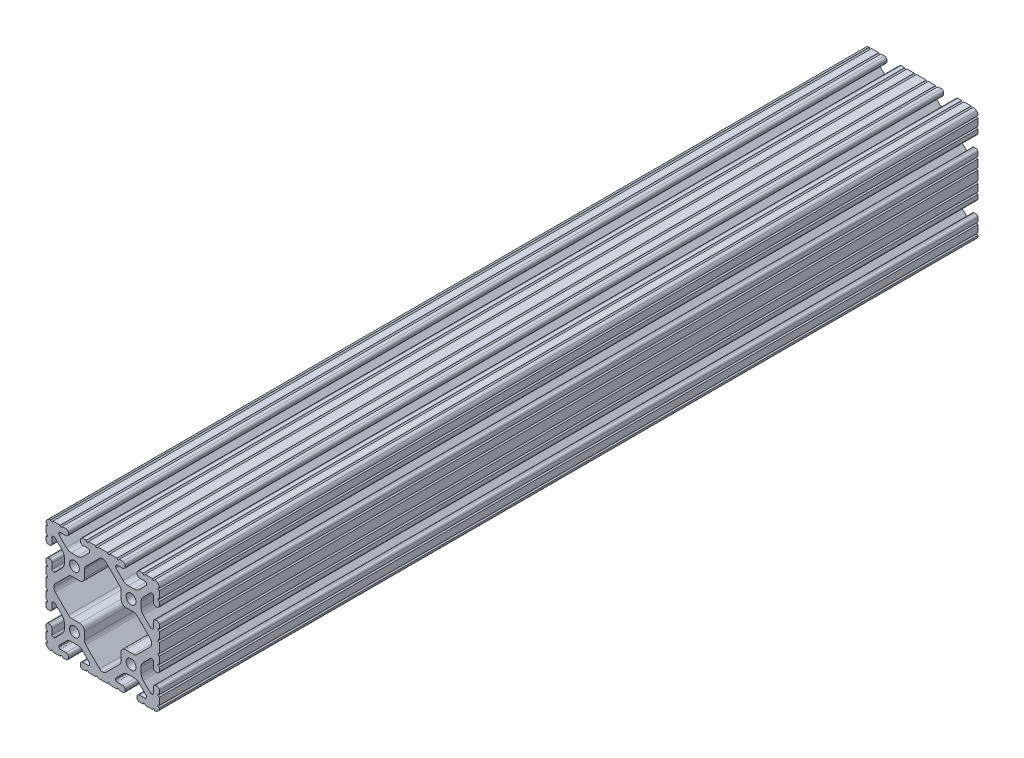
from build123d import *

# Parameters (mm, degrees)
BOSS_EXTRUDE1_DEPTH      = 275
BOSS_EXTRUDE1_DEPTH_BACK = 275
SKETCH3_R                = 3.3274


with BuildPart() as part:
    # Sketch3 → Boss-Extrude1 (new, two sides: drawn at the far end of the back side and taken through both)
    with BuildSketch(Plane.XY.offset(-BOSS_EXTRUDE1_DEPTH_BACK)):
        with BuildLine():
            Line((34.036, 28.448), (34.036, 24.630196049))
            ThreePointArc((34.036, 24.630196049), (34.497248241, 23.51664429), (35.6108, 23.055396049))
            Line((35.6108, 23.055396049), (36.525200183, 23.055396049))
            ThreePointArc((36.525200183, 23.055396049), (37.638751813, 23.516644236), (38.1, 24.630195866))
            Line((38.1, 24.630195866), (38.1, 27.023826138))
            ThreePointArc((38.1, 27.023826138), (37.117780706, 27.7845421), (38.1, 28.545258062))
            Line((38.1, 28.545258062), (38.1, 33.373016026))
            ThreePointArc((38.1, 33.373016026), (37.141472621, 34.109236774), (38.1, 34.845457521))
            ThreePointArc((38.1, 34.845457521), (37.837757813, 36.120195002), (37.086123144, 37.182631793))
            ThreePointArc((37.086123144, 37.182631793), (36.106286572, 37.843374398), (34.952681874, 38.1))
            ThreePointArc((34.952681874, 38.1), (34.190730434, 37.320215335), (33.428778994, 38.1))
            Line((33.428778994, 38.1), (28.601105935, 38.1))
            ThreePointArc((28.601105935, 38.1), (27.839158581, 37.32021942), (27.077211227, 38.1))
            Line((27.077211227, 38.1), (24.6888, 38.1))
            ThreePointArc((24.6888, 38.1), (23.575248241, 37.638751759), (23.114, 36.5252))
            Line((23.114, 36.5252), (23.114, 35.6108))
            ThreePointArc((23.114, 35.6108), (23.575248241, 34.497248241), (24.6888, 34.036))
            Line((24.6888, 34.036), (28.448, 34.036))
            ThreePointArc((28.448, 34.036), (29.076617928, 33.775617928), (29.337, 33.147))
            Line((29.337, 33.147), (29.337, 32.720693454))
            ThreePointArc((29.337, 32.720693454), (29.326675076, 32.273872751), (29.100231244, 31.888543625))
            Line((29.100231244, 31.888543625), (24.409287499, 27.197588341))
            ThreePointArc((24.409287499, 27.197588341), (22.868340045, 26.167958114), (21.050667579, 25.8064))
            Line((21.050667579, 25.8064), (17.049332421, 25.8064))
            ThreePointArc((17.049332421, 25.8064), (15.231659955, 26.167958114), (13.690712501, 27.197588341))
            Line((13.690712501, 27.197588341), (9.023381298, 31.864931024))
            ThreePointArc((9.023381298, 31.864931024), (8.830670886, 32.153343113), (8.763, 32.493548179))
            Line((8.763, 32.493548179), (8.763, 33.147))
            ThreePointArc((8.763, 33.147), (9.023382072, 33.775617928), (9.652, 34.036))
            Line((9.652, 34.036), (13.4112, 34.036))
            ThreePointArc((13.4112, 34.036), (14.524751759, 34.497248241), (14.986, 35.6108))
            Line((14.986, 35.6108), (14.986, 36.5252))
            ThreePointArc((14.986, 36.5252), (14.524751759, 37.638751759), (13.4112, 38.1))
            Line((13.4112, 38.1), (11.128867074, 38.1))
            ThreePointArc((11.128867074, 38.1), (10.367071033, 37.320370693), (9.605274992, 38.1))
            Line((9.605274992, 38.1), (4.777313069, 38.1))
            ThreePointArc((4.777313069, 38.1), (4.015517029, 37.320370693), (3.253720988, 38.1))
            Line((3.253720988, 38.1), (-3.253720988, 38.1))
            ThreePointArc((-3.253720988, 38.1), (-4.015517029, 37.320370693), (-4.777313069, 38.1))
            Line((-4.777313069, 38.1), (-9.605274992, 38.1))
            ThreePointArc((-9.605274992, 38.1), (-10.367071033, 37.320370693), (-11.128867074, 38.1))
            Line((-11.128867074, 38.1), (-13.4112, 38.1))
            ThreePointArc((-13.4112, 38.1), (-14.524751759, 37.638751759), (-14.986, 36.5252))
            Line((-14.986, 36.5252), (-14.986, 35.6108))
            ThreePointArc((-14.986, 35.6108), (-14.524751759, 34.497248241), (-13.4112, 34.036))
            Line((-13.4112, 34.036), (-9.652, 34.036))
            ThreePointArc((-9.652, 34.036), (-9.023382072, 33.775617928), (-8.763, 33.147))
            Line((-8.763, 33.147), (-8.763, 32.493548179))
            ThreePointArc((-8.763, 32.493548179), (-8.830670886, 32.153343113), (-9.023381298, 31.864931024))
            Line((-9.023381298, 31.864931024), (-13.690712501, 27.197588341))
            ThreePointArc((-13.690712501, 27.197588341), (-15.231659955, 26.167958114), (-17.049332421, 25.8064))
            Line((-17.049332421, 25.8064), (-21.050667579, 25.8064))
            ThreePointArc((-21.050667579, 25.8064), (-22.868340045, 26.167958114), (-24.409287499, 27.197588341))
            Line((-24.409287499, 27.197588341), (-29.100231244, 31.888543625))
            ThreePointArc((-29.100231244, 31.888543625), (-29.326675076, 32.273872751), (-29.337, 32.720693454))
            Line((-29.337, 32.720693454), (-29.337, 33.147))
            ThreePointArc((-29.337, 33.147), (-29.076617928, 33.775617928), (-28.448, 34.036))
            Line((-28.448, 34.036), (-24.6888, 34.036))
            ThreePointArc((-24.6888, 34.036), (-23.575248241, 34.497248241), (-23.114, 35.6108))
            Line((-23.114, 35.6108), (-23.114, 36.5252))
            ThreePointArc((-23.114, 36.5252), (-23.575248241, 37.638751759), (-24.6888, 38.1))
            Line((-24.6888, 38.1), (-27.077211227, 38.1))
            ThreePointArc((-27.077211227, 38.1), (-27.839158581, 37.32021942), (-28.601105935, 38.1))
            Line((-28.601105935, 38.1), (-33.428778994, 38.1))
            ThreePointArc((-33.428778994, 38.1), (-34.190730434, 37.320215335), (-34.952681874, 38.1))
            ThreePointArc((-34.952681874, 38.1), (-36.106286572, 37.843374398), (-37.086123144, 37.182631793))
            ThreePointArc((-37.086123144, 37.182631793), (-37.837757813, 36.120195002), (-38.1, 34.845457521))
            ThreePointArc((-38.1, 34.845457521), (-37.141472621, 34.109236774), (-38.1, 33.373016026))
            Line((-38.1, 33.373016026), (-38.1, 28.545258062))
            ThreePointArc((-38.1, 28.545258062), (-37.117780706, 27.7845421), (-38.1, 27.023826138))
            Line((-38.1, 27.023826138), (-38.1, 24.630195866))
            ThreePointArc((-38.1, 24.630195866), (-37.638751813, 23.516644236), (-36.525200183, 23.055396049))
            Line((-36.525200183, 23.055396049), (-35.6108, 23.055396049))
            ThreePointArc((-35.6108, 23.055396049), (-34.497248241, 23.51664429), (-34.036, 24.630196049))
            Line((-34.036, 24.630196049), (-34.036, 28.448))
            ThreePointArc((-34.036, 28.448), (-33.775617928, 29.076617928), (-33.147, 29.337))
            Line((-33.147, 29.337), (-32.664287242, 29.337))
            ThreePointArc((-32.664287242, 29.337), (-32.324081166, 29.269328695), (-32.03566854, 29.076617155))
            Line((-32.03566854, 29.076617155), (-27.19758008, 24.238516795))
            ThreePointArc((-27.19758008, 24.238516795), (-26.167955879, 22.697572205), (-25.8064, 20.879905136))
            Line((-25.8064, 20.879905136), (-25.8064, 17.220094864))
            ThreePointArc((-25.8064, 17.220094864), (-26.167955879, 15.402427795), (-27.19758008, 13.861483205))
            Line((-27.19758008, 13.861483205), (-31.948944541, 9.110107057))
            ThreePointArc((-31.948944541, 9.110107057), (-32.333417096, 8.853210196), (-32.786933649, 8.763))
            Line((-32.786933649, 8.763), (-33.060275787, 8.763))
            ThreePointArc((-33.060275787, 8.763), (-33.750216995, 9.048783005), (-34.036, 9.738724213))
            Line((-34.036, 9.738724213), (-34.036, 13.469803585))
            ThreePointArc((-34.036, 13.469803585), (-34.497248348, 14.583355603), (-35.610800366, 15.044603951))
            Line((-35.610800366, 15.044603951), (-36.5252, 15.044603951))
            ThreePointArc((-36.5252, 15.044603951), (-37.638751759, 14.58335571), (-38.1, 13.469803951))
            Line((-38.1, 13.469803951), (-38.1, 11.075039289))
            ThreePointArc((-38.1, 11.075039289), (-37.117000248, 10.313517272), (-38.1, 9.551995255))
            Line((-38.1, 9.551995255), (-38.1, 4.723759308))
            ThreePointArc((-38.1, 4.723759308), (-37.117000248, 3.962237292), (-38.1, 3.200715275))
            Line((-38.1, 3.200715275), (-38.1, -3.200715275))
            ThreePointArc((-38.1, -3.200715275), (-37.117000248, -3.962237292), (-38.1, -4.723759308))
            Line((-38.1, -4.723759308), (-38.1, -9.551995255))
            ThreePointArc((-38.1, -9.551995255), (-37.117000248, -10.313517272), (-38.1, -11.075039289))
            Line((-38.1, -11.075039289), (-38.1, -13.469803951))
            ThreePointArc((-38.1, -13.469803951), (-37.638751759, -14.58335571), (-36.5252, -15.044603951))
            Line((-36.5252, -15.044603951), (-35.610800366, -15.044603951))
            ThreePointArc((-35.610800366, -15.044603951), (-34.497248348, -14.583355603), (-34.036, -13.469803585))
            Line((-34.036, -13.469803585), (-34.036, -9.738724213))
            ThreePointArc((-34.036, -9.738724213), (-33.750216995, -9.048783005), (-33.060275787, -8.763))
            Line((-33.060275787, -8.763), (-32.786933649, -8.763))
            ThreePointArc((-32.786933649, -8.763), (-32.333417096, -8.853210196), (-31.948944541, -9.110107057))
            Line((-31.948944541, -9.110107057), (-27.19758008, -13.861483205))
            ThreePointArc((-27.19758008, -13.861483205), (-26.167955879, -15.402427795), (-25.8064, -17.220094864))
            Line((-25.8064, -17.220094864), (-25.8064, -20.879905136))
            ThreePointArc((-25.8064, -20.879905136), (-26.167955879, -22.697572205), (-27.19758008, -24.238516795))
            Line((-27.19758008, -24.238516795), (-32.03566854, -29.076617155))
            ThreePointArc((-32.03566854, -29.076617155), (-32.324081166, -29.269328695), (-32.664287242, -29.337))
            Line((-32.664287242, -29.337), (-33.147, -29.337))
            ThreePointArc((-33.147, -29.337), (-33.775617928, -29.076617928), (-34.036, -28.448))
            Line((-34.036, -28.448), (-34.036, -24.630196049))
            ThreePointArc((-34.036, -24.630196049), (-34.497248241, -23.51664429), (-35.6108, -23.055396049))
            Line((-35.6108, -23.055396049), (-36.525200183, -23.055396049))
            ThreePointArc((-36.525200183, -23.055396049), (-37.638751813, -23.516644236), (-38.1, -24.630195866))
            Line((-38.1, -24.630195866), (-38.1, -27.023826138))
            ThreePointArc((-38.1, -27.023826138), (-37.117780706, -27.7845421), (-38.1, -28.545258062))
            Line((-38.1, -28.545258062), (-38.1, -33.373016026))
            ThreePointArc((-38.1, -33.373016026), (-37.141472621, -34.109236774), (-38.1, -34.845457521))
            ThreePointArc((-38.1, -34.845457521), (-37.837757813, -36.120195002), (-37.086123144, -37.182631793))
            ThreePointArc((-37.086123144, -37.182631793), (-36.106286572, -37.843374398), (-34.952681874, -38.1))
            ThreePointArc((-34.952681874, -38.1), (-34.190730434, -37.320215335), (-33.428778994, -38.1))
            Line((-33.428778994, -38.1), (-28.601105935, -38.1))
            ThreePointArc((-28.601105935, -38.1), (-27.839158581, -37.32021942), (-27.077211227, -38.1))
            Line((-27.077211227, -38.1), (-24.6888, -38.1))
            ThreePointArc((-24.6888, -38.1), (-23.575248241, -37.638751759), (-23.114, -36.5252))
            Line((-23.114, -36.5252), (-23.114, -35.6108))
            ThreePointArc((-23.114, -35.6108), (-23.575248241, -34.497248241), (-24.6888, -34.036))
            Line((-24.6888, -34.036), (-28.448, -34.036))
            ThreePointArc((-28.448, -34.036), (-29.076617928, -33.775617928), (-29.337, -33.147))
            Line((-29.337, -33.147), (-29.337, -32.720693454))
            ThreePointArc((-29.337, -32.720693454), (-29.326675076, -32.273872751), (-29.100231244, -31.888543625))
            Line((-29.100231244, -31.888543625), (-24.409287499, -27.197588341))
            ThreePointArc((-24.409287499, -27.197588341), (-22.868340045, -26.167958114), (-21.050667579, -25.8064))
            Line((-21.050667579, -25.8064), (-17.049332421, -25.8064))
            ThreePointArc((-17.049332421, -25.8064), (-15.231659955, -26.167958114), (-13.690712501, -27.197588341))
            Line((-13.690712501, -27.197588341), (-9.023381298, -31.864931024))
            ThreePointArc((-9.023381298, -31.864931024), (-8.830670886, -32.153343113), (-8.763, -32.493548179))
            Line((-8.763, -32.493548179), (-8.763, -33.147))
            ThreePointArc((-8.763, -33.147), (-9.023382072, -33.775617928), (-9.652, -34.036))
            Line((-9.652, -34.036), (-13.4112, -34.036))
            ThreePointArc((-13.4112, -34.036), (-14.524751759, -34.497248241), (-14.986, -35.6108))
            Line((-14.986, -35.6108), (-14.986, -36.5252))
            ThreePointArc((-14.986, -36.5252), (-14.524751759, -37.638751759), (-13.4112, -38.1))
            Line((-13.4112, -38.1), (-11.128867074, -38.1))
            ThreePointArc((-11.128867074, -38.1), (-10.367071033, -37.320370693), (-9.605274992, -38.1))
            Line((-9.605274992, -38.1), (-4.777313069, -38.1))
            ThreePointArc((-4.777313069, -38.1), (-4.015517029, -37.320370693), (-3.253720988, -38.1))
            Line((-3.253720988, -38.1), (3.253720988, -38.1))
            ThreePointArc((3.253720988, -38.1), (4.015517029, -37.320370693), (4.777313069, -38.1))
            Line((4.777313069, -38.1), (9.605274992, -38.1))
            ThreePointArc((9.605274992, -38.1), (10.367071033, -37.320370693), (11.128867074, -38.1))
            Line((11.128867074, -38.1), (13.4112, -38.1))
            ThreePointArc((13.4112, -38.1), (14.524751759, -37.638751759), (14.986, -36.5252))
            Line((14.986, -36.5252), (14.986, -35.6108))
            ThreePointArc((14.986, -35.6108), (14.524751759, -34.497248241), (13.4112, -34.036))
            Line((13.4112, -34.036), (9.652, -34.036))
            ThreePointArc((9.652, -34.036), (9.023382072, -33.775617928), (8.763, -33.147))
            Line((8.763, -33.147), (8.763, -32.493548179))
            ThreePointArc((8.763, -32.493548179), (8.830670886, -32.153343113), (9.023381298, -31.864931024))
            Line((9.023381298, -31.864931024), (13.690712501, -27.197588341))
            ThreePointArc((13.690712501, -27.197588341), (15.231659955, -26.167958114), (17.049332421, -25.8064))
            Line((17.049332421, -25.8064), (21.050667579, -25.8064))
            ThreePointArc((21.050667579, -25.8064), (22.868340045, -26.167958114), (24.409287499, -27.197588341))
            Line((24.409287499, -27.197588341), (29.100231244, -31.888543625))
            ThreePointArc((29.100231244, -31.888543625), (29.326675076, -32.273872751), (29.337, -32.720693454))
            Line((29.337, -32.720693454), (29.337, -33.147))
            ThreePointArc((29.337, -33.147), (29.076617928, -33.775617928), (28.448, -34.036))
            Line((28.448, -34.036), (24.6888, -34.036))
            ThreePointArc((24.6888, -34.036), (23.575248241, -34.497248241), (23.114, -35.6108))
            Line((23.114, -35.6108), (23.114, -36.5252))
            ThreePointArc((23.114, -36.5252), (23.575248241, -37.638751759), (24.6888, -38.1))
            Line((24.6888, -38.1), (27.077211227, -38.1))
            ThreePointArc((27.077211227, -38.1), (27.839158581, -37.32021942), (28.601105935, -38.1))
            Line((28.601105935, -38.1), (33.428778994, -38.1))
            ThreePointArc((33.428778994, -38.1), (34.190730434, -37.320215335), (34.952681874, -38.1))
            ThreePointArc((34.952681874, -38.1), (36.106286572, -37.843374398), (37.086123144, -37.182631793))
            ThreePointArc((37.086123144, -37.182631793), (37.837757813, -36.120195002), (38.1, -34.845457521))
            ThreePointArc((38.1, -34.845457521), (37.141472621, -34.109236774), (38.1, -33.373016026))
            Line((38.1, -33.373016026), (38.1, -28.545258062))
            ThreePointArc((38.1, -28.545258062), (37.117780706, -27.7845421), (38.1, -27.023826138))
            Line((38.1, -27.023826138), (38.1, -24.630195866))
            ThreePointArc((38.1, -24.630195866), (37.638751813, -23.516644236), (36.525200183, -23.055396049))
            Line((36.525200183, -23.055396049), (35.6108, -23.055396049))
            ThreePointArc((35.6108, -23.055396049), (34.497248241, -23.51664429), (34.036, -24.630196049))
            Line((34.036, -24.630196049), (34.036, -28.448))
            ThreePointArc((34.036, -28.448), (33.775617928, -29.076617928), (33.147, -29.337))
            Line((33.147, -29.337), (32.664287242, -29.337))
            ThreePointArc((32.664287242, -29.337), (32.324081166, -29.269328695), (32.03566854, -29.076617155))
            Line((32.03566854, -29.076617155), (27.19758008, -24.238516795))
            ThreePointArc((27.19758008, -24.238516795), (26.167955879, -22.697572205), (25.8064, -20.879905136))
            Line((25.8064, -20.879905136), (25.8064, -17.220094864))
            ThreePointArc((25.8064, -17.220094864), (26.167955879, -15.402427795), (27.19758008, -13.861483205))
            Line((27.19758008, -13.861483205), (31.948944541, -9.110107057))
            ThreePointArc((31.948944541, -9.110107057), (32.333417096, -8.853210196), (32.786933649, -8.763))
            Line((32.786933649, -8.763), (33.060275787, -8.763))
            ThreePointArc((33.060275787, -8.763), (33.750216995, -9.048783005), (34.036, -9.738724213))
            Line((34.036, -9.738724213), (34.036, -13.469803585))
            ThreePointArc((34.036, -13.469803585), (34.497248348, -14.583355603), (35.610800366, -15.044603951))
            Line((35.610800366, -15.044603951), (36.5252, -15.044603951))
            ThreePointArc((36.5252, -15.044603951), (37.638751759, -14.58335571), (38.1, -13.469803951))
            Line((38.1, -13.469803951), (38.1, -11.075039289))
            ThreePointArc((38.1, -11.075039289), (37.117000248, -10.313517272), (38.1, -9.551995255))
            Line((38.1, -9.551995255), (38.1, -4.723759308))
            ThreePointArc((38.1, -4.723759308), (37.117000248, -3.962237292), (38.1, -3.200715275))
            Line((38.1, -3.200715275), (38.1, 3.200715275))
            ThreePointArc((38.1, 3.200715275), (37.117000248, 3.962237292), (38.1, 4.723759308))
            Line((38.1, 4.723759308), (38.1, 9.551995255))
            ThreePointArc((38.1, 9.551995255), (37.117000248, 10.313517272), (38.1, 11.075039289))
            Line((38.1, 11.075039289), (38.1, 13.469803951))
            ThreePointArc((38.1, 13.469803951), (37.638751759, 14.58335571), (36.5252, 15.044603951))
            Line((36.5252, 15.044603951), (35.610800366, 15.044603951))
            ThreePointArc((35.610800366, 15.044603951), (34.497248348, 14.583355603), (34.036, 13.469803585))
            Line((34.036, 13.469803585), (34.036, 9.738724213))
            ThreePointArc((34.036, 9.738724213), (33.750216995, 9.048783005), (33.060275787, 8.763))
            Line((33.060275787, 8.763), (32.786933649, 8.763))
            ThreePointArc((32.786933649, 8.763), (32.333417096, 8.853210196), (31.948944541, 9.110107057))
            Line((31.948944541, 9.110107057), (27.19758008, 13.861483205))
            ThreePointArc((27.19758008, 13.861483205), (26.167955879, 15.402427795), (25.8064, 17.220094864))
            Line((25.8064, 17.220094864), (25.8064, 20.879905136))
            ThreePointArc((25.8064, 20.879905136), (26.167955879, 22.697572205), (27.19758008, 24.238516795))
            Line((27.19758008, 24.238516795), (32.03566854, 29.076617155))
            ThreePointArc((32.03566854, 29.076617155), (32.324081166, 29.269328695), (32.664287242, 29.337))
            Line((32.664287242, 29.337), (33.147, 29.337))
            ThreePointArc((33.147, 29.337), (33.775617928, 29.076617928), (34.036, 28.448))
        make_face()
        with Locations((19.05, 19.05)):
            Circle(SKETCH3_R, mode=Mode.SUBTRACT)
        with Locations((-19.05, 19.05)):
            Circle(SKETCH3_R, mode=Mode.SUBTRACT)
        with Locations((19.05, -19.05)):
            Circle(SKETCH3_R, mode=Mode.SUBTRACT)
        with Locations((-19.05, -19.05)):
            Circle(SKETCH3_R, mode=Mode.SUBTRACT)
        with BuildLine():
            Line((-11.363666791, -22.843321003), (-2.051515952, -32.155494748))
            ThreePointArc((-2.051515952, -32.155494748), (-1.11031328, -32.786013752), (0, -33.011005091))
            ThreePointArc((0, -33.011005091), (1.11031328, -32.786013752), (2.051515952, -32.155494748))
            Line((2.051515952, -32.155494748), (11.363666791, -22.843321003))
            ThreePointArc((11.363666791, -22.843321003), (12.051918263, -21.813277828), (12.2936, -20.598259734))
            Line((12.2936, -20.598259734), (12.2936, -15.4686))
            ThreePointArc((12.2936, -15.4686), (13.22353597, -13.22353597), (15.4686, -12.2936))
            Line((15.4686, -12.2936), (20.769026744, -12.2936))
            ThreePointArc((20.769026744, -12.2936), (21.984048446, -12.051916769), (23.014093535, -11.363661269))
            Line((23.014093535, -11.363661269), (31.902125566, -2.475607377))
            ThreePointArc((31.902125566, -2.475607377), (32.607298578, -1.335259481), (32.728725173, 0))
            ThreePointArc((32.728725173, 0), (32.607298578, 1.335259481), (31.902125566, 2.475607377))
            Line((31.902125566, 2.475607377), (23.014093535, 11.363661269))
            ThreePointArc((23.014093535, 11.363661269), (21.984048446, 12.051916769), (20.769026744, 12.2936))
            Line((20.769026744, 12.2936), (15.4686, 12.2936))
            ThreePointArc((15.4686, 12.2936), (13.22353597, 13.22353597), (12.2936, 15.4686))
            Line((12.2936, 15.4686), (12.2936, 20.598259734))
            ThreePointArc((12.2936, 20.598259734), (12.051918263, 21.813277828), (11.363666791, 22.843321003))
            Line((11.363666791, 22.843321003), (2.051515952, 32.155494748))
            ThreePointArc((2.051515952, 32.155494748), (1.11031328, 32.786013752), (0, 33.011005091))
            ThreePointArc((0, 33.011005091), (-1.11031328, 32.786013752), (-2.051515952, 32.155494748))
            Line((-2.051515952, 32.155494748), (-11.363666791, 22.843321003))
            ThreePointArc((-11.363666791, 22.843321003), (-12.051918263, 21.813277828), (-12.2936, 20.598259734))
            Line((-12.2936, 20.598259734), (-12.2936, 15.4686))
            ThreePointArc((-12.2936, 15.4686), (-13.22353597, 13.22353597), (-15.4686, 12.2936))
            Line((-15.4686, 12.2936), (-20.769026744, 12.2936))
            ThreePointArc((-20.769026744, 12.2936), (-21.984048446, 12.051916769), (-23.014093535, 11.363661269))
            Line((-23.014093535, 11.363661269), (-31.902125566, 2.475607377))
            ThreePointArc((-31.902125566, 2.475607377), (-32.607298578, 1.335259481), (-32.728725173, 0))
            ThreePointArc((-32.728725173, 0), (-32.607298578, -1.335259481), (-31.902125566, -2.475607377))
            Line((-31.902125566, -2.475607377), (-23.014093535, -11.363661269))
            ThreePointArc((-23.014093535, -11.363661269), (-21.984048446, -12.051916769), (-20.769026744, -12.2936))
            Line((-20.769026744, -12.2936), (-15.4686, -12.2936))
            ThreePointArc((-15.4686, -12.2936), (-13.22353597, -13.22353597), (-12.2936, -15.4686))
            Line((-12.2936, -15.4686), (-12.2936, -20.598259734))
            ThreePointArc((-12.2936, -20.598259734), (-12.051918263, -21.813277828), (-11.363666791, -22.843321003))
        make_face(mode=Mode.SUBTRACT)
    extrude(amount=BOSS_EXTRUDE1_DEPTH + BOSS_EXTRUDE1_DEPTH_BACK)


solid = part.part
